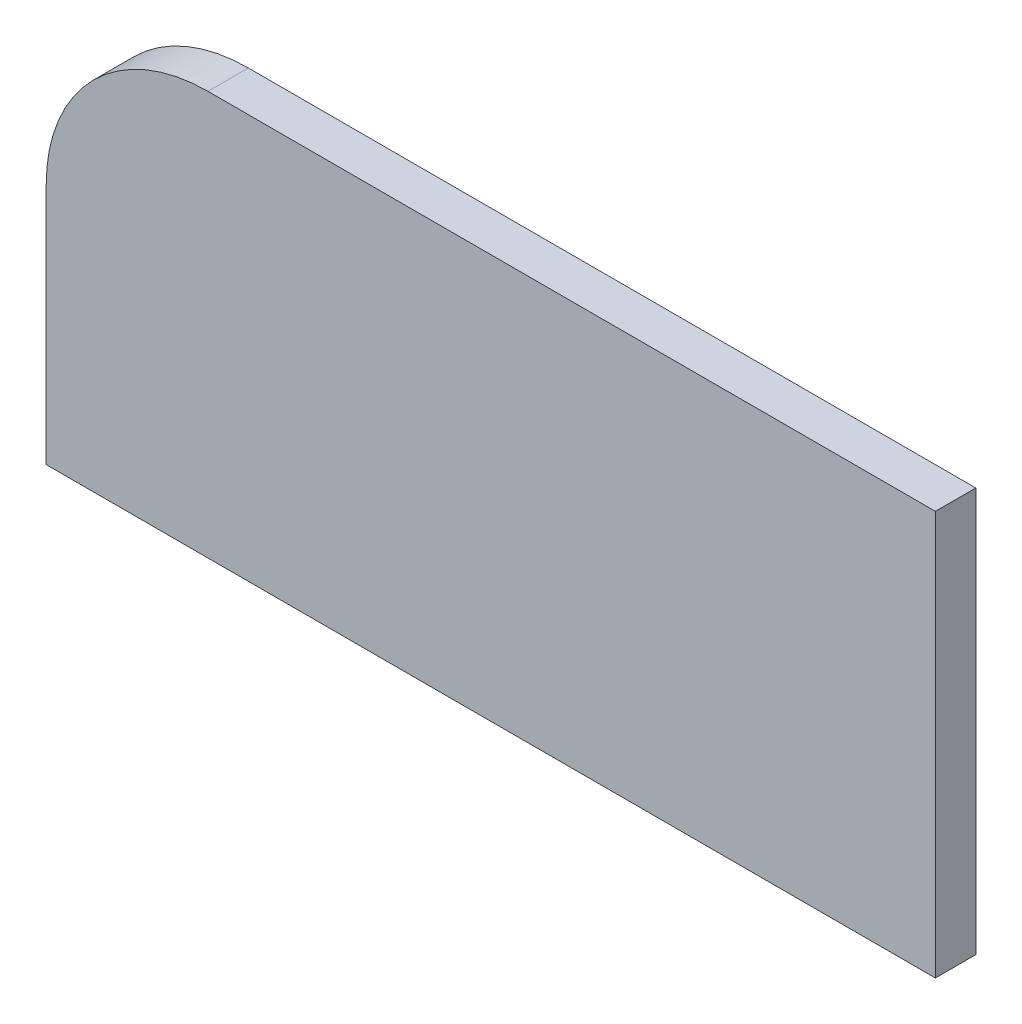
from build123d import *

# Parameters (mm, degrees)
SKETCH1_W           = 110
SKETCH1_H           = 50
BOSS_EXTRUDE1_DEPTH = 5
FILLET1_R           = 20


with BuildPart() as part:
    # Sketch1 → Boss-Extrude1 (new body)
    with BuildSketch(Plane.XY):
        with Locations((55, 25)):
            Rectangle(SKETCH1_W, SKETCH1_H)
    extrude(amount=BOSS_EXTRUDE1_DEPTH)

    # Fillet1
    fillet1_edges = [part.edges().sort_by_distance(p)[0] for p in [
        (0, 50, 2.5),
    ]]
    fillet(fillet1_edges, radius=FILLET1_R)


solid = part.part
